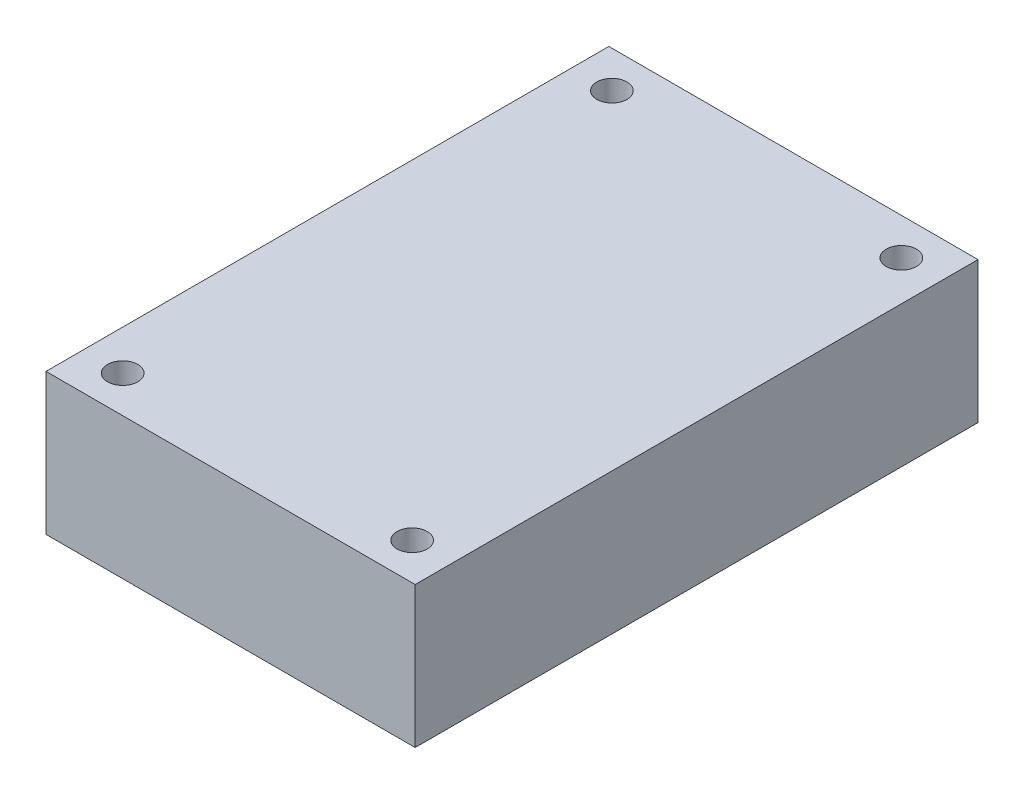
from build123d import *

# Parameters (mm, degrees)
SKETCH_1_W          = 36.6
SKETCH_1_H          = 55.8
EXTRUDE_1_DEPTH     = 14
SKETCH_3_R          = 1.5
CUT_EXTRUDE_1_DEPTH = 37.184250718


with BuildPart() as part:
    # 草图1 → 凸台-拉伸1 (new body)
    with BuildSketch(Plane(origin=(0, 0, 0), x_dir=(1, 0, 0), z_dir=(0, 1, 0))):
        Rectangle(SKETCH_1_W, SKETCH_1_H)
    extrude(amount=EXTRUDE_1_DEPTH)

    # 草图3 → 切除-拉伸1 (cut, through all)
    with BuildSketch(Plane(origin=(0, 0, 0), x_dir=(1, 0, 0), z_dir=(0, 1, 0))):
        with Locations(Location((-14.35, 24.25, 0), (0, 0, 270))):
            Circle(SKETCH_3_R)
        with Locations(Location((-14.35, -24.25, 0), (0, 0, 90))):
            Circle(SKETCH_3_R)
        with Locations(Location((14.35, -24.25, 0), (0, 0, 270))):
            Circle(SKETCH_3_R)
        with Locations(Location((14.35, 24.25, 0), (0, 0, 90))):
            Circle(SKETCH_3_R)
    extrude(amount=CUT_EXTRUDE_1_DEPTH, mode=Mode.SUBTRACT)


solid = part.part
